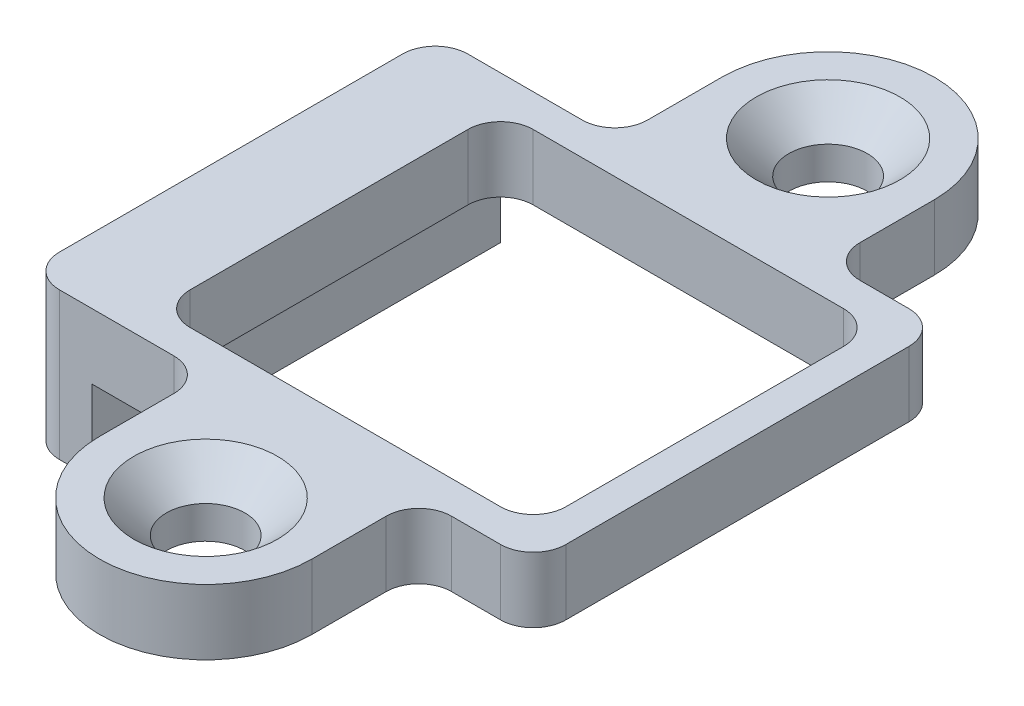
from build123d import *

# Parameters (mm, degrees)
SKETCH1_W                                      = 11.5
SKETCH1_H                                      = 10.5
BOSS_EXTRUDE1_DEPTH                            = 2
SKETCH1_4_W                                    = 2
SKETCH1_4_H                                    = 12.5
BOSS_EXTRUDE2_DEPTH                            = 2.5
CSK_FOR_M2_FLAT_HEAD_MACHINE_SCREW2_AT_2_COUNT = 2
CSK_FOR_M2_FLAT_HEAD_MACHINE_SCREW2_AT_2_PITCH = 19.05
CSK_FOR_M2_FLAT_HEAD_MACHINE_SCREW2_AT_3_COUNT = 2
CSK_FOR_M2_FLAT_HEAD_MACHINE_SCREW2_AT_3_PITCH = 19.05
FILLET1_R                                      = 1


with BuildPart() as part:
    # Sketch1 → Boss-Extrude1 (new body)
    with BuildSketch(Plane(origin=(0, 0, 0), x_dir=(1, 0, 0), z_dir=(0, 1, 0))):
        with BuildLine():
            ThreePointArc((3.25, 9.525), (0, 12.775), (-3.25, 9.525))
            Line((-3.25, 9.525), (-3.25, 6.25))
            Line((-3.25, 6.25), (-8.75, 6.25))
            Line((-8.75, 6.25), (-8.75, -6.25))
            Line((-8.75, -6.25), (-3.25, -6.25))
            Line((-3.25, -6.25), (-3.25, -9.525))
            ThreePointArc((-3.25, -9.525), (0, -12.775), (3.25, -9.525))
            Line((3.25, -9.525), (3.25, -6.25))
            Line((3.25, -6.25), (6.75, -6.25))
            Line((6.75, -6.25), (6.75, 6.25))
            Line((6.75, 6.25), (3.25, 6.25))
            Line((3.25, 6.25), (3.25, 9.525))
        make_face()
        Rectangle(SKETCH1_W, SKETCH1_H, mode=Mode.SUBTRACT)
    extrude(amount=BOSS_EXTRUDE1_DEPTH)

    # Sketch1<4> → Boss-Extrude2 (add)
    with BuildSketch(Plane(origin=(0, 0, 0), x_dir=(1, 0, 0), z_dir=(0, 1, 0))):
        with Locations((-7.75, 0)):
            Rectangle(SKETCH1_4_W, SKETCH1_4_H)
    extrude(amount=-BOSS_EXTRUDE2_DEPTH)

    # Sketch3 → CSK for M2 Flat Head Machine Screw2 (revolve, cut)
    with BuildSketch(Plane(origin=(0, 2, -9.525), x_dir=(0, 0, 1), z_dir=(1, 0, 0))):
        Polygon((0, 0), (0, 4.5), (1.2, 4.5), (1.2, 1), (2.2, 0), align=None)
    csk_for_m2_flat_head_machine_screw2 = revolve(axis=Axis((0, 8.35, -9.525), (0, -1, 0)), mode=Mode.SUBTRACT)

    # CSK for M2 Flat Head Machine Screw2 at 2: CSK for M2 Flat Head Machine Screw2 ×2
    with Locations(*[(0, 0, i * CSK_FOR_M2_FLAT_HEAD_MACHINE_SCREW2_AT_2_PITCH) for i in range(1, CSK_FOR_M2_FLAT_HEAD_MACHINE_SCREW2_AT_2_COUNT)]):
        add(csk_for_m2_flat_head_machine_screw2, mode=Mode.SUBTRACT)

    # CSK for M2 Flat Head Machine Screw2 at 3: CSK for M2 Flat Head Machine Screw2 ×2
    with Locations(*[(0, 0, i * CSK_FOR_M2_FLAT_HEAD_MACHINE_SCREW2_AT_3_PITCH) for i in range(1, CSK_FOR_M2_FLAT_HEAD_MACHINE_SCREW2_AT_3_COUNT)]):
        add(csk_for_m2_flat_head_machine_screw2, mode=Mode.SUBTRACT)

    # Fillet1
    fillet1_edges = [part.edges().sort_by_distance(p)[0] for p in [
        (-8.75, -0.25, 6.25),
        (-8.75, -0.25, -6.25),
        (-3.25, 1, -6.25),
        (3.25, 1, -6.25),
        (3.25, 1, 6.25),
        (-3.25, 1, 6.25),
        (6.75, 1, 6.25),
        (6.75, 1, -6.25),
        (5.75, 1, -5.25),
        (-5.75, 1, -5.25),
        (5.75, 1, 5.25),
        (-5.75, 1, 5.25),
    ]]
    fillet(fillet1_edges, radius=FILLET1_R)


solid = part.part
